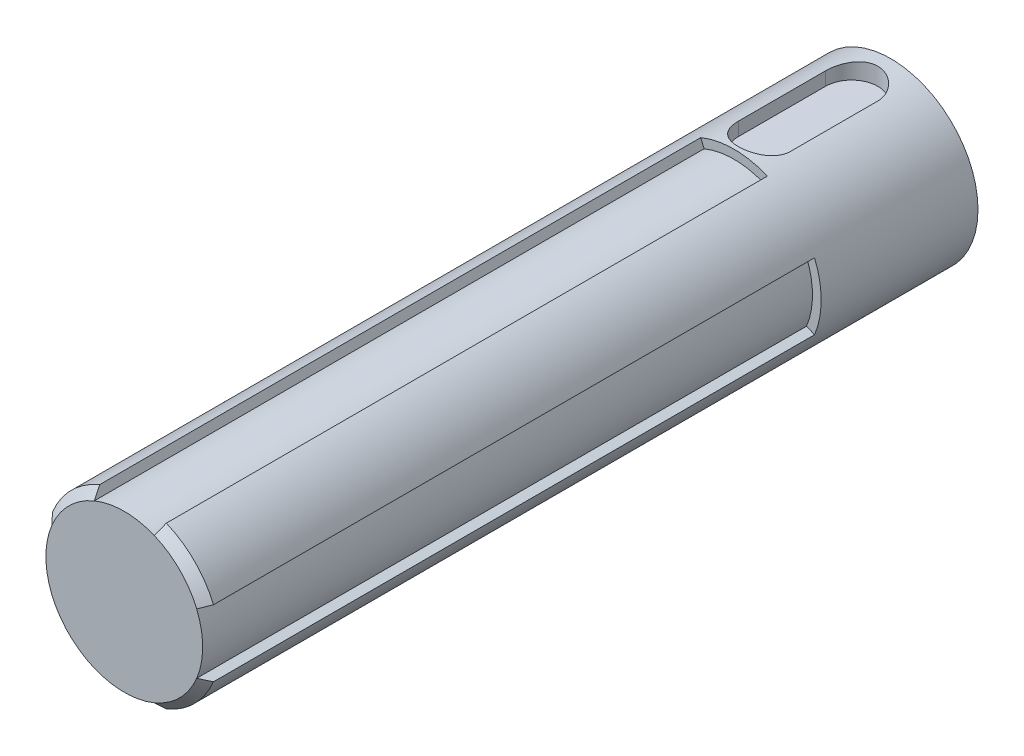
from build123d import *

# Parameters (mm, degrees)
CROQUIS1_R              = 10
SALIENTE_EXTRUIR1_DEPTH = 88
CHAFL_N1_SIZE           = 1
CORTAR_EXTRUIR1_START   = -70
CORTAR_EXTRUIR1_DEPTH   = 70
CORTAR_EXTRUIR5_DEPTH   = 2


with BuildPart() as part:
    # Croquis1 → Saliente-Extruir1 (new body)
    with BuildSketch(Plane.XY):
        Circle(CROQUIS1_R)
    extrude(amount=SALIENTE_EXTRUIR1_DEPTH)

    # Chaflán1
    chafl_n1_edges = [part.edges().sort_by_distance(p)[0] for p in [
        (-10, 0, 88),
    ]]
    chamfer(chafl_n1_edges, length=CHAFL_N1_SIZE)

    # Croquis3 → Cortar-Extruir1 (cut)
    with BuildSketch(Plane.XY.offset(88).offset(CORTAR_EXTRUIR1_START)):
        with BuildLine():
            ThreePointArc((3.826834324, 9.238795325), (0, 10), (-3.826834324, 9.238795325))
            Line((-3.826834324, 9.238795325), (-3.444150891, 8.314915793))
            ThreePointArc((-3.444150891, 8.314915793), (0, 9), (3.444150891, 8.314915793))
            Line((3.444150891, 8.314915793), (3.826834324, 9.238795325))
        make_face()
        with BuildLine():
            ThreePointArc((10, 0), (9.807852804, 1.95090322), (9.238795325, 3.826834324))
            Line((9.238795325, 3.826834324), (8.314915793, 3.444150891))
            ThreePointArc((8.314915793, 3.444150891), (8.827067524, 1.755812898), (9, 0))
            ThreePointArc((9, 0), (8.827067524, -1.755812898), (8.314915793, -3.444150891))
            Line((8.314915793, -3.444150891), (9.238795325, -3.826834324))
            ThreePointArc((9.238795325, -3.826834324), (9.807852804, -1.95090322), (10, 0))
        make_face()
        with BuildLine():
            Line((-3.444150891, -8.314915793), (-3.826834324, -9.238795325))
            ThreePointArc((-3.826834324, -9.238795325), (0, -10), (3.826834324, -9.238795325))
            Line((3.826834324, -9.238795325), (3.444150891, -8.314915793))
            ThreePointArc((3.444150891, -8.314915793), (0, -9), (-3.444150891, -8.314915793))
        make_face()
        with BuildLine():
            Line((-8.314915793, 3.444150891), (-9.238795325, 3.826834324))
            ThreePointArc((-9.238795325, 3.826834324), (-10, 0), (-9.238795325, -3.826834324))
            Line((-9.238795325, -3.826834324), (-8.314915793, -3.444150891))
            ThreePointArc((-8.314915793, -3.444150891), (-9, 0), (-8.314915793, 3.444150891))
        make_face()
    extrude(amount=CORTAR_EXTRUIR1_DEPTH, mode=Mode.SUBTRACT)

    # Croquis4 → Cortar-Extruir5 (cut)
    with BuildSketch(Plane(origin=(0, 10, 0), x_dir=(1, 0, 0), z_dir=(0, 1, 0))):
        with BuildLine():
            Line((-3, -14.5), (-3, -4.5))
            ThreePointArc((-3, -4.5), (0, -1.5), (3, -4.5))
            Line((3, -4.5), (3, -14.5))
            ThreePointArc((3, -14.5), (0, -17.5), (-3, -14.5))
        make_face()
    extrude(amount=-CORTAR_EXTRUIR5_DEPTH, mode=Mode.SUBTRACT)


solid = part.part
